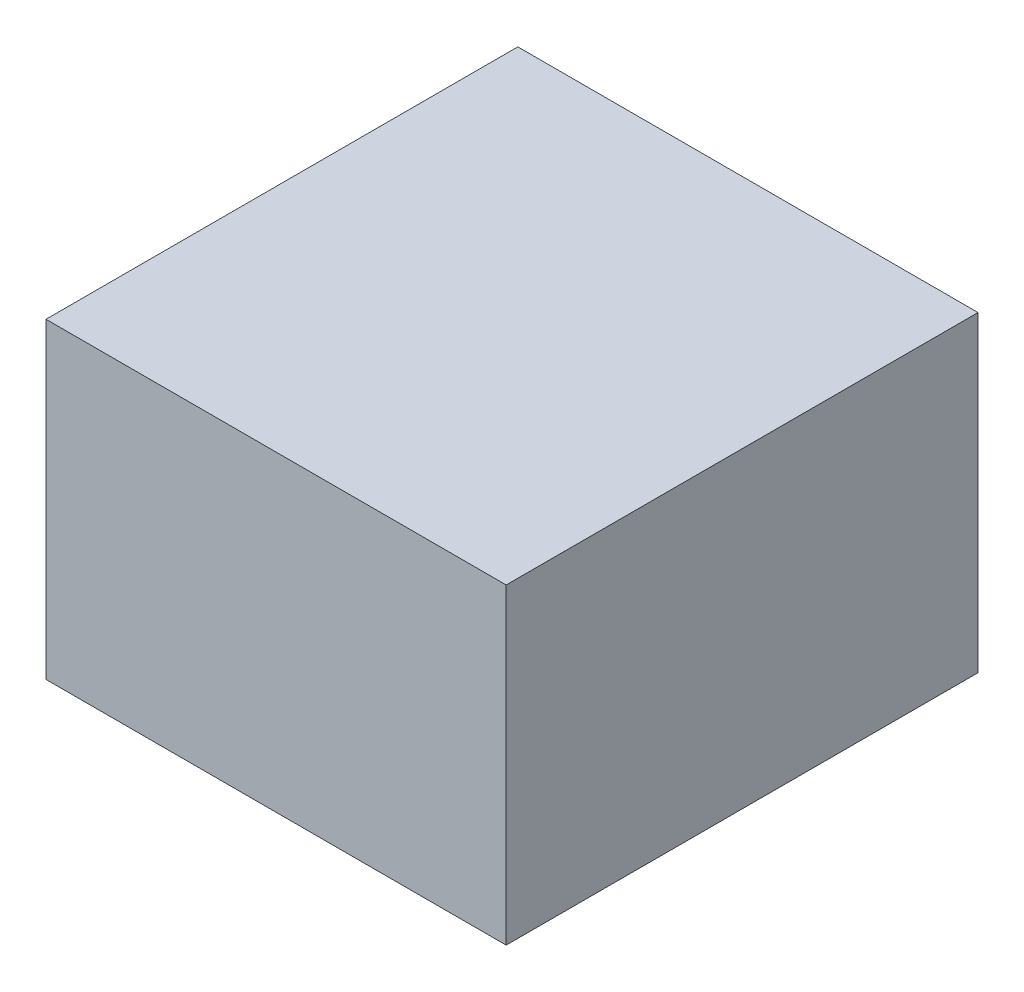
from build123d import *

# Parameters (mm, degrees)
SKETCH1_W           = 157.37844214
SKETCH1_H           = 161.355514686
BOSS_EXTRUDE1_DEPTH = 53.34


with BuildPart() as part:
    # Sketch1 → Boss-Extrude1 (new, symmetric)
    with BuildSketch(Plane(origin=(0, 0, 0), x_dir=(1, 0, 0), z_dir=(0, 1, 0))):
        Rectangle(SKETCH1_W, SKETCH1_H)
    extrude(amount=BOSS_EXTRUDE1_DEPTH, both=True)


solid = part.part
